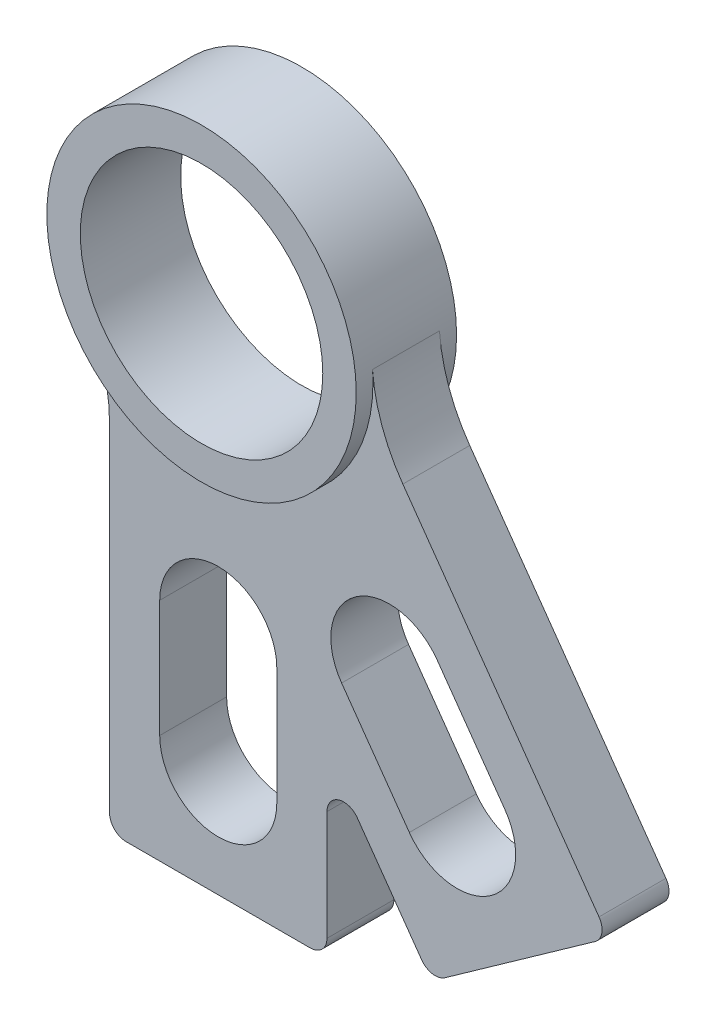
from build123d import *
from build123d.topology import SkipClean

# Parameters (mm, degrees)
BOSS_EXTRUDE1_DEPTH      = 4.7625
BOSS_EXTRUDE1_DEPTH_BACK = 4.7625
SKETCH1_R                = 11.5062
CUT_EXTRUDE1_START       = -4.7625
CUT_EXTRUDE1_DEPTH       = 1.5875
CUT_EXTRUDE2_START       = 3.175
CUT_EXTRUDE2_DEPTH       = 1.5875
FILLET1_R                = 1.5875


with BuildPart() as part:
    # Sketch1 → Boss-Extrude1 (new, two sides: drawn at the far end of the back side and taken through both)
    # profile 1 of 2: a face of its own
    with BuildSketch(Plane.XY.offset(-BOSS_EXTRUDE1_DEPTH_BACK)):
        with BuildLine():
            ThreePointArc((14.639156809, 1.110279863), (-4.45502565, 13.988937769), (-12.585193267, -7.559797873))
            ThreePointArc((-12.585193267, -7.559797873), (4.45502565, -13.988937769), (14.639156809, 1.110279863))
        make_face()
        Circle(SKETCH1_R, mode=Mode.SUBTRACT)
    # profile 2 of 2: a face of its own
    with BuildSketch(Plane.XY.offset(-BOSS_EXTRUDE1_DEPTH_BACK)):
        with BuildLine():
            ThreePointArc((-12.585193267, -7.559797873), (4.45502565, -13.988937769), (14.639156809, 1.110279863))
            ThreePointArc((14.639156809, 1.110279863), (15.535368252, -3.075379389), (17.517315641, -6.869430374))
            Line((17.517315641, -6.869430374), (37.052935248, -34.429965394))
            Line((37.052935248, -34.429965394), (20.216142238, -46.364319477))
            Line((20.216142238, -46.364319477), (10.31875, -32.401239172))
            Line((10.31875, -32.401239172), (10.31875, -49.389319794))
            Line((10.31875, -49.389319794), (-10.31875, -49.389319794))
            Line((-10.31875, -49.389319794), (-10.31875, -15.734319794))
            ThreePointArc((-10.31875, -15.734319794), (-10.89585042, -11.492870345), (-12.585193267, -7.559797873))
        make_face()
        with BuildLine():
            ThreePointArc((20.774153775, -19.699685133), (13.028075711, -18.379797729), (11.708188308, -26.125875793))
            Line((11.708188308, -26.125875793), (18.134378968, -35.19184126))
            ThreePointArc((18.134378968, -35.19184126), (25.880457031, -36.511728663), (27.200344435, -28.7656506))
            Line((27.200344435, -28.7656506), (20.774153775, -19.699685133))
        make_face(mode=Mode.SUBTRACT)
        with BuildLine():
            ThreePointArc((5.55625, -27.958069794), (0, -22.401819794), (-5.55625, -27.958069794))
            Line((-5.55625, -27.958069794), (-5.55625, -39.070569794))
            ThreePointArc((-5.55625, -39.070569794), (0, -44.626819794), (5.55625, -39.070569794))
            Line((5.55625, -39.070569794), (5.55625, -27.958069794))
        make_face(mode=Mode.SUBTRACT)
    extrude(amount=BOSS_EXTRUDE1_DEPTH + BOSS_EXTRUDE1_DEPTH_BACK)

    # Sketch2 → Cut-Extrude1 (cut)
    with BuildSketch(Plane.XY.offset(CUT_EXTRUDE1_START)):
        with BuildLine():
            Line((-10.31875, -15.734319794), (-10.31875, -49.389319794))
            Line((-10.31875, -49.389319794), (10.31875, -49.389319794))
            Line((10.31875, -49.389319794), (10.31875, -32.401239172))
            Line((10.31875, -32.401239172), (20.216142238, -46.364319477))
            Line((20.216142238, -46.364319477), (37.052935248, -34.429965394))
            Line((37.052935248, -34.429965394), (17.517315641, -6.869430374))
            ThreePointArc((17.517315641, -6.869430374), (15.535368252, -3.075379389), (14.639156809, 1.110279863))
            ThreePointArc((14.639156809, 1.110279863), (4.45502565, -13.988937769), (-12.585193267, -7.559797873))
            ThreePointArc((-12.585193267, -7.559797873), (-10.89585042, -11.492870345), (-10.31875, -15.734319794))
        make_face()
        with BuildLine():
            Line((-5.55625, -39.070569794), (-5.55625, -27.958069794))
            ThreePointArc((-5.55625, -27.958069794), (0, -22.401819794), (5.55625, -27.958069794))
            Line((5.55625, -27.958069794), (5.55625, -39.070569794))
            ThreePointArc((5.55625, -39.070569794), (0, -44.626819794), (-5.55625, -39.070569794))
        make_face(mode=Mode.SUBTRACT)
        with BuildLine():
            Line((18.134378968, -35.19184126), (11.708188308, -26.125875793))
            ThreePointArc((11.708188308, -26.125875793), (13.028075711, -18.379797729), (20.774153775, -19.699685133))
            Line((20.774153775, -19.699685133), (27.200344435, -28.7656506))
            ThreePointArc((27.200344435, -28.7656506), (25.880457031, -36.511728663), (18.134378968, -35.19184126))
        make_face(mode=Mode.SUBTRACT)
    extrude(amount=CUT_EXTRUDE1_DEPTH, mode=Mode.SUBTRACT)

    # Sketch2<6> → Cut-Extrude2 (cut)
    with SkipClean():  # the faces are left unmerged after this step: merging them gives an invalid solid
        with BuildSketch(Plane.XY.offset(CUT_EXTRUDE2_START)):
            with BuildLine():
                Line((-10.31875, -15.734319794), (-10.31875, -49.389319794))
                Line((-10.31875, -49.389319794), (10.31875, -49.389319794))
                Line((10.31875, -49.389319794), (10.31875, -32.401239172))
                Line((10.31875, -32.401239172), (20.216142238, -46.364319477))
                Line((20.216142238, -46.364319477), (37.052935248, -34.429965394))
                Line((37.052935248, -34.429965394), (17.517315641, -6.869430374))
                ThreePointArc((17.517315641, -6.869430374), (15.535368252, -3.075379389), (14.639156809, 1.110279863))
                ThreePointArc((14.639156809, 1.110279863), (4.45502565, -13.988937769), (-12.585193267, -7.559797873))
                ThreePointArc((-12.585193267, -7.559797873), (-10.89585042, -11.492870345), (-10.31875, -15.734319794))
            make_face()
            with BuildLine():
                Line((-5.55625, -39.070569794), (-5.55625, -27.958069794))
                ThreePointArc((-5.55625, -27.958069794), (0, -22.401819794), (5.55625, -27.958069794))
                Line((5.55625, -27.958069794), (5.55625, -39.070569794))
                ThreePointArc((5.55625, -39.070569794), (0, -44.626819794), (-5.55625, -39.070569794))
            make_face(mode=Mode.SUBTRACT)
            with BuildLine():
                Line((18.134378968, -35.19184126), (11.708188308, -26.125875793))
                ThreePointArc((11.708188308, -26.125875793), (13.028075711, -18.379797729), (20.774153775, -19.699685133))
                Line((20.774153775, -19.699685133), (27.200344435, -28.7656506))
                ThreePointArc((27.200344435, -28.7656506), (25.880457031, -36.511728663), (18.134378968, -35.19184126))
            make_face(mode=Mode.SUBTRACT)
        extrude(amount=CUT_EXTRUDE2_DEPTH, mode=Mode.SUBTRACT)

    # Fillet1
    fillet1_edges = [part.edges().sort_by_distance(p)[0] for p in [
        (-10.31875, -49.389319794, 0),
        (10.31875, -49.389319794, 0),
        (10.31875, -32.401239172, 0),
        (20.216142238, -46.364319477, 0),
        (37.052935248, -34.429965394, 0),
    ]]
    fillet(fillet1_edges, radius=FILLET1_R)


solid = part.part
